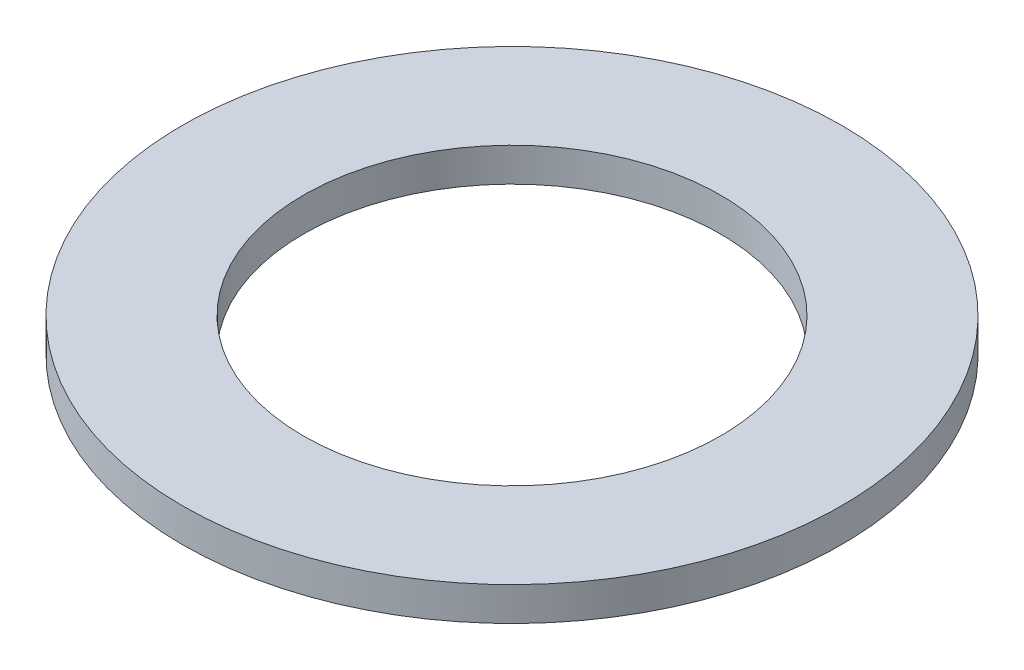
from build123d import *

# Parameters (mm, degrees)
SKETCH1_R           = 78.2
SKETCH1_R_2         = 49.5
BOSS_EXTRUDE1_DEPTH = 8


with BuildPart() as part:
    # Sketch1 → Boss-Extrude1 (new body)
    with BuildSketch(Plane(origin=(0, 0, 0), x_dir=(1, 0, 0), z_dir=(0, 1, 0))):
        with Locations(Location((0, 0, 0), (0, 0, 270))):
            Circle(SKETCH1_R)
        with Locations(Location((0, 0, 0), (0, 0, 270))):
            Circle(SKETCH1_R_2, mode=Mode.SUBTRACT)
    extrude(amount=BOSS_EXTRUDE1_DEPTH)


solid = part.part
